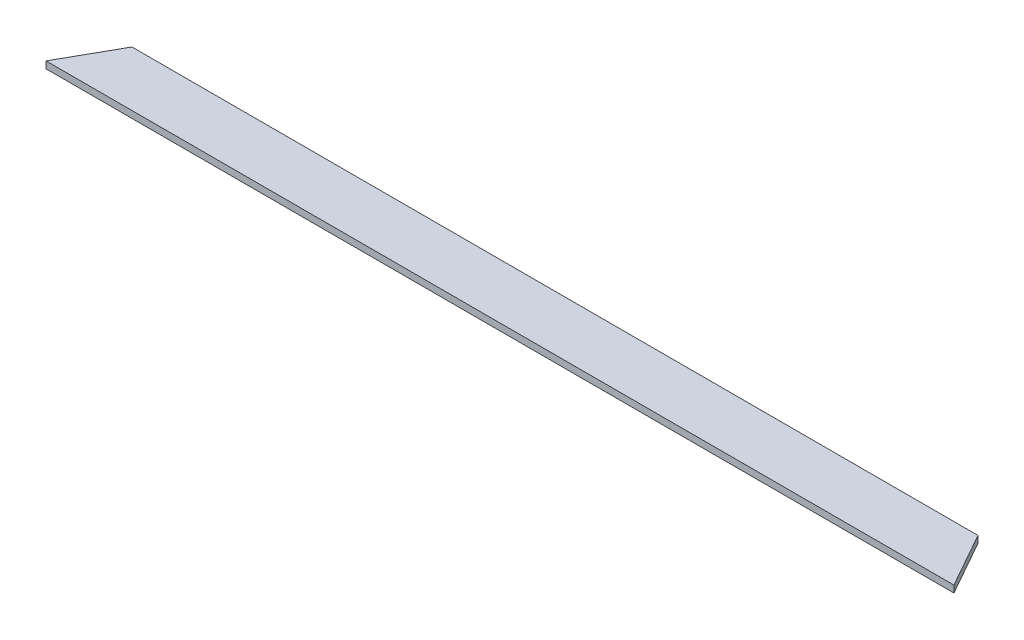
from build123d import *

# Parameters (mm, degrees)
BOSS_EXTRUDE1_DEPTH = 3.175


with BuildPart() as part:
    # Sketch1 → Boss-Extrude1 (new body)
    with BuildSketch(Plane(origin=(0, 0, 0), x_dir=(1, 0, 0), z_dir=(0, 1, 0))):
        Polygon((0, 0), (195.2625, 0), (209.55, -25.4), (-209.55, -25.4), (-195.2625, 0), align=None)
    extrude(amount=BOSS_EXTRUDE1_DEPTH)


solid = part.part
